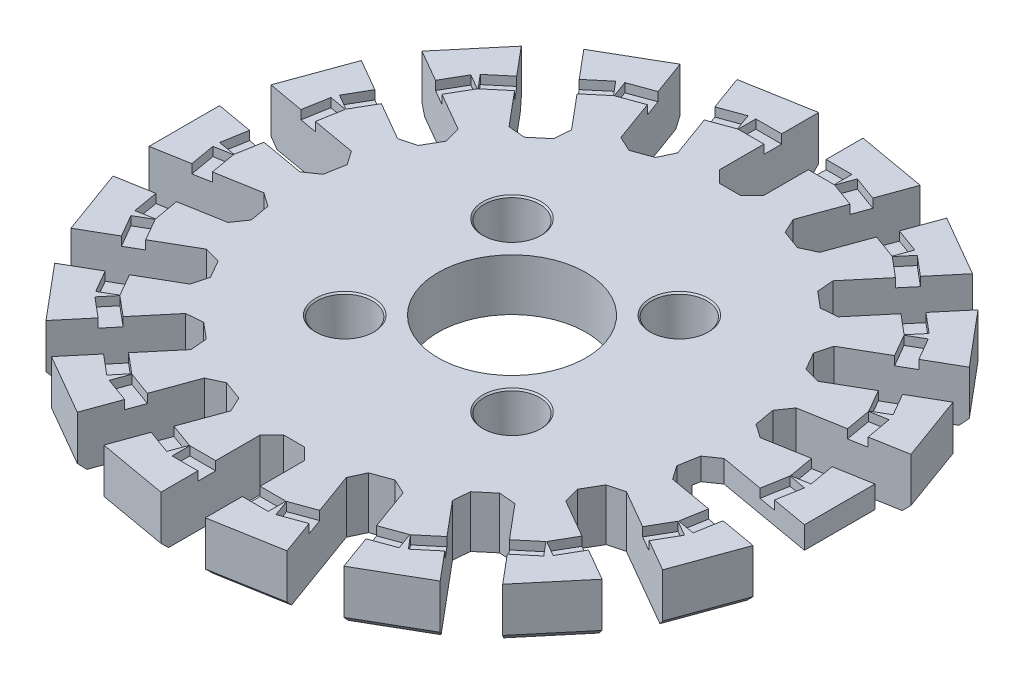
from build123d import *

# Parameters (mm, degrees)
BOSS_EXTRUDE1_DEPTH = 3.5
CHAMFER1_SIZE       = 0.8
SKETCH2_W           = 6.5
SKETCH2_H           = 1.2
CUT_EXTRUDE1_DEPTH  = 0.6
CHAMFER2_SIZE       = 0.5
SKETCH4_R           = 1.5
SKETCH4_R_2         = 5
CUT_EXTRUDE4_DEPTH  = 3.5
SKETCH12_W          = 17.763085067
SKETCH12_H          = 4.76788816
CUT_EXTRUDE9_DEPTH  = 2
SKETCH15_R          = 1.875
CUT_EXTRUDE10_DEPTH = 3
CHAMFER3_SIZE       = 0.1


with BuildPart() as part:
    # Sketch1 → Boss-Extrude1 (new body)
    with BuildSketch(Plane(origin=(0, 0, 0), x_dir=(1, 0, 0), z_dir=(0, 1, 0))):
        Polygon((-1.5, 22.235509529), (-1.5, 14.735509529), (1.5, 14.735509529), (1.5, 22.235509529), (6.195453225, 21.407574439), (3.63030215, 14.359879783), (6.449380012, 13.333819353), (9.014531087, 20.381514009), (13.143643356, 17.997569929), (8.322736283, 12.252236606), (10.620869612, 10.323873777), (15.441776685, 16.0692071), (18.506516118, 12.41679287), (12.01132559, 8.66679287), (13.51132559, 6.068716659), (20.006516118, 9.818716659), (21.63722991, 5.338367339), (14.251171762, 4.036006006), (14.772116295, 1.081582747), (22.158174443, 2.38394408), (22.158174443, -2.38394408), (14.772116295, -1.081582747), (14.251171762, -4.036006006), (21.63722991, -5.338367339), (20.006516118, -9.818716659), (13.51132559, -6.068716659), (12.01132559, -8.66679287), (18.506516118, -12.41679287), (15.441776685, -16.0692071), (10.620869612, -10.323873777), (8.322736283, -12.252236606), (13.143643356, -17.997569929), (9.014531087, -20.381514009), (6.449380012, -13.333819353), (3.63030215, -14.359879783), (6.195453225, -21.407574439), (1.5, -22.235509529), (1.5, -14.735509529), (-1.5, -14.735509529), (-1.5, -22.235509529), (-6.195453225, -21.407574439), (-3.63030215, -14.359879783), (-6.449380012, -13.333819353), (-9.014531087, -20.381514009), (-13.143643356, -17.997569929), (-8.322736283, -12.252236606), (-10.620869612, -10.323873777), (-15.441776685, -16.0692071), (-18.506516118, -12.41679287), (-12.01132559, -8.66679287), (-13.51132559, -6.068716659), (-20.006516118, -9.818716659), (-21.63722991, -5.338367339), (-14.251171762, -4.036006006), (-14.772116295, -1.081582747), (-22.158174443, -2.38394408), (-22.158174443, 2.38394408), (-14.772116295, 1.081582747), (-14.251171762, 4.036006006), (-21.63722991, 5.338367339), (-20.006516118, 9.818716659), (-13.51132559, 6.068716659), (-12.01132559, 8.66679287), (-18.506516118, 12.41679287), (-15.441776685, 16.0692071), (-10.620869612, 10.323873777), (-8.322736283, 12.252236606), (-13.143643356, 17.997569929), (-9.014531087, 20.381514009), (-6.449380012, 13.333819353), (-3.63030215, 14.359879783), (-6.195453225, 21.407574439), align=None)
    extrude(amount=BOSS_EXTRUDE1_DEPTH)

    # Chamfer1
    chamfer1_edges = [part.edges().sort_by_distance(p)[0] for p in [
        (-1.5, 1.75, -14.735509529),
        (1.5, 1.75, -14.735509529),
        (3.63030215, 1.75, -14.359879783),
        (6.449380012, 1.75, -13.333819353),
        (8.322736283, 1.75, -12.252236606),
        (10.620869612, 1.75, -10.323873777),
        (12.01132559, 1.75, -8.66679287),
        (13.51132559, 1.75, -6.068716659),
        (14.251171762, 1.75, -4.036006006),
        (14.772116295, 1.75, -1.081582747),
        (14.772116295, 1.75, 1.081582747),
        (14.251171762, 1.75, 4.036006006),
        (13.51132559, 1.75, 6.068716659),
        (12.01132559, 1.75, 8.66679287),
        (10.620869612, 1.75, 10.323873777),
        (8.322736283, 1.75, 12.252236606),
        (6.449380012, 1.75, 13.333819353),
        (3.63030215, 1.75, 14.359879783),
        (1.5, 1.75, 14.735509529),
        (-1.5, 1.75, 14.735509529),
        (-3.63030215, 1.75, 14.359879783),
        (-6.449380012, 1.75, 13.333819353),
        (-8.322736283, 1.75, 12.252236606),
        (-10.620869612, 1.75, 10.323873777),
        (-12.01132559, 1.75, 8.66679287),
        (-13.51132559, 1.75, 6.068716659),
        (-14.251171762, 1.75, 4.036006006),
        (-14.772116295, 1.75, 1.081582747),
        (-14.772116295, 1.75, -1.081582747),
        (-14.251171762, 1.75, -4.036006006),
        (-13.51132559, 1.75, -6.068716659),
        (-12.01132559, 1.75, -8.66679287),
        (-10.620869612, 1.75, -10.323873777),
        (-8.322736283, 1.75, -12.252236606),
        (-6.449380012, 1.75, -13.333819353),
        (-3.63030215, 1.75, -14.359879783),
    ]]
    chamfer(chamfer1_edges, length=CHAMFER1_SIZE)

    # Sketch2 → Cut-Extrude1 (cut)
    with BuildSketch(Plane(origin=(0, 3.5, 0), x_dir=(1, 0, 0), z_dir=(0, 1, 0))):
        with Locations((0, 19.135509529)):
            Rectangle(SKETCH2_W, SKETCH2_H)
        Polygon((3.285516608, 18.529246993), (3.69594078, 19.656878138), (9.803942815, 17.433747206), (9.393518643, 16.306116061), align=None)
        Polygon((9.424751424, 16.288083807), (10.196096556, 17.207337138), (15.175385436, 13.029217675), (14.404040305, 12.109964344), align=None)
        Polygon((14.427222124, 12.082337327), (15.466452609, 12.682337327), (18.716452609, 7.053172202), (17.677222124, 6.453172202), align=None)
        Polygon((17.689556913, 6.419282649), (18.871326216, 6.627660462), (20.000039371, 0.226410068), (18.818270068, 0.018032255), align=None)
        Polygon((18.818270068, -0.018032255), (20.000039371, -0.226410068), (18.871326216, -6.627660462), (17.689556913, -6.419282649), align=None)
        Polygon((17.677222124, -6.453172202), (18.716452609, -7.053172202), (15.466452609, -12.682337327), (14.427222124, -12.082337327), align=None)
        Polygon((14.404040305, -12.109964344), (15.175385436, -13.029217675), (10.196096556, -17.207337138), (9.424751424, -16.288083807), align=None)
        Polygon((9.393518643, -16.306116061), (9.803942815, -17.433747206), (3.69594078, -19.656878138), (3.285516608, -18.529246993), align=None)
        with Locations((0, -19.135509529)):
            Rectangle(SKETCH2_W, SKETCH2_H)
        Polygon((-3.285516608, -18.529246993), (-3.69594078, -19.656878138), (-9.803942815, -17.433747206), (-9.393518643, -16.306116061), align=None)
        Polygon((-9.424751424, -16.288083807), (-10.196096556, -17.207337138), (-15.175385436, -13.029217675), (-14.404040305, -12.109964344), align=None)
        Polygon((-14.427222124, -12.082337327), (-15.466452609, -12.682337327), (-18.716452609, -7.053172202), (-17.677222124, -6.453172202), align=None)
        Polygon((-17.689556913, -6.419282649), (-18.871326216, -6.627660462), (-20.000039371, -0.226410068), (-18.818270068, -0.018032255), align=None)
        Polygon((-18.818270068, 0.018032255), (-20.000039371, 0.226410068), (-18.871326216, 6.627660462), (-17.689556913, 6.419282649), align=None)
        Polygon((-17.677222124, 6.453172202), (-18.716452609, 7.053172202), (-15.466452609, 12.682337327), (-14.427222124, 12.082337327), align=None)
        Polygon((-14.404040305, 12.109964344), (-15.175385436, 13.029217675), (-10.196096556, 17.207337138), (-9.424751424, 16.288083807), align=None)
        Polygon((-9.393518643, 16.306116061), (-9.803942815, 17.433747206), (-3.69594078, 19.656878138), (-3.285516608, 18.529246993), align=None)
    extrude(amount=-CUT_EXTRUDE1_DEPTH, mode=Mode.SUBTRACT)

    # Chamfer2
    chamfer2_edges = [part.edges().sort_by_distance(p)[0] for p in [
        (3.847726612, 0, -21.821541984),
        (11.079087221, 0, -19.189541969),
        (16.974146402, 0, -14.242999985),
        (20.821873014, 0, -7.578541999),
        (22.158174443, 0, 0),
        (20.821873014, 0, 7.578541999),
        (16.974146402, 0, 14.242999985),
        (11.079087221, 0, 19.189541969),
        (3.847726612, 0, 21.821541984),
        (-3.847726612, 0, 21.821541984),
        (-11.079087221, 0, 19.189541969),
        (-16.974146402, 0, 14.242999985),
        (-20.821873014, 0, 7.578541999),
        (-22.158174443, 0, 0),
        (-20.821873014, 0, -7.578541999),
        (-16.974146402, 0, -14.242999985),
        (-11.079087221, 0, -19.189541969),
        (-3.847726612, 0, -21.821541984),
    ]]
    chamfer(chamfer2_edges, length=CHAMFER2_SIZE)

    # Sketch4 → Cut-Extrude4 (cut)
    with BuildSketch(Plane.XZ):
        with Locations(Location((-5.656854249, 5.656854249, 0), (0, 0, 270))):
            Circle(SKETCH4_R)
        with Locations(Location((5.656854249, 5.656854249, 0), (0, 0, 270))):
            Circle(SKETCH4_R)
        with Locations(Location((5.656854249, -5.656854249, 0), (0, 0, 270))):
            Circle(SKETCH4_R)
        with Locations(Location((-5.656854249, -5.656854249, 0), (0, 0, 270))):
            Circle(SKETCH4_R)
        with Locations(Location((0, 0, 0), (0, 0, 270))):
            Circle(SKETCH4_R_2)
    extrude(amount=-CUT_EXTRUDE4_DEPTH, mode=Mode.SUBTRACT)

    # Sketch12 → Cut-Extrude9 (cut)
    with BuildSketch(Plane.XZ):
        with Locations((13.27663191, 0)):
            Rectangle(SKETCH12_W, SKETCH12_H)
    extrude(amount=-CUT_EXTRUDE9_DEPTH, mode=Mode.SUBTRACT)

    # Sketch15 → Cut-Extrude10 (cut)
    with BuildSketch(Plane(origin=(0, 3.5, 0), x_dir=(1, 0, 0), z_dir=(0, 1, 0))):
        with Locations(Location((5.656854249, 5.656854249, 0), (0, 0, 270))):
            Circle(SKETCH15_R)
        with Locations(Location((-5.656854249, 5.656854249, 0), (0, 0, 270))):
            Circle(SKETCH15_R)
        with Locations(Location((-5.656854249, -5.656854249, 0), (0, 0, 270))):
            Circle(SKETCH15_R)
        with Locations(Location((5.656854249, -5.656854249, 0), (0, 0, 270))):
            Circle(SKETCH15_R)
    extrude(amount=-CUT_EXTRUDE10_DEPTH, mode=Mode.SUBTRACT)

    # Chamfer3
    chamfer3_edges = [part.edges().sort_by_distance(p)[0] for p in [
        (5.656854249, 3.5, 3.781854249),
        (-5.656854249, 3.5, 3.781854249),
        (-5.656854249, 3.5, -7.531854249),
        (5.656854249, 3.5, -7.531854249),
    ]]
    chamfer(chamfer3_edges, length=CHAMFER3_SIZE)


solid = part.part
